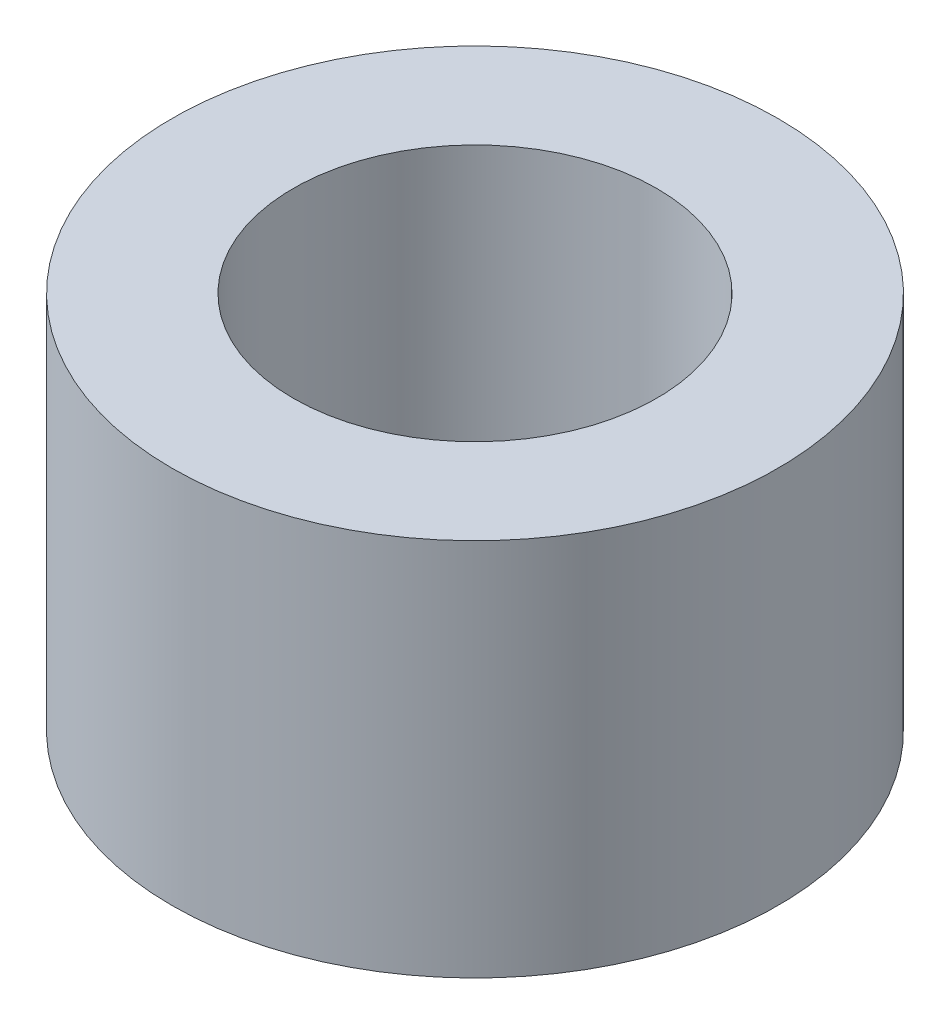
from build123d import *

# Parameters (mm, degrees)
ESQUISSE1_R             = 4
BOSS_EXTRU_1_DEPTH      = 5
ESQUISSE3_R             = 1.5
ENL_V_MAT_EXTRU_2_DEPTH = 8.549834435
ESQUISSE2_R             = 2.4
ENL_V_MAT_EXTRU_3_DEPTH = 4


with BuildPart() as part:
    # Esquisse1 → Boss.-Extru.1 (new body)
    with BuildSketch(Plane(origin=(0, 0, 0), x_dir=(1, 0, 0), z_dir=(0, 1, 0))):
        with Locations(Location((0, 0, 0), (0, 0, 270))):
            Circle(ESQUISSE1_R)
    extrude(amount=BOSS_EXTRU_1_DEPTH)

    # Esquisse3 → Enlèv. mat.-Extru.2 (cut, through all)
    with BuildSketch(Plane.XZ):
        with Locations(Location((0, 0, 0), (0, 0, 270))):
            Circle(ESQUISSE3_R)
    extrude(amount=-ENL_V_MAT_EXTRU_2_DEPTH, mode=Mode.SUBTRACT)

    # Esquisse2 → Enlèv. mat.-Extru.3 (cut)
    with BuildSketch(Plane(origin=(0, 5, 0), x_dir=(1, 0, 0), z_dir=(0, 1, 0))):
        with Locations(Location((0, 0, 0), (0, 0, 270))):
            Circle(ESQUISSE2_R)
    extrude(amount=-ENL_V_MAT_EXTRU_3_DEPTH, mode=Mode.SUBTRACT)


solid = part.part
